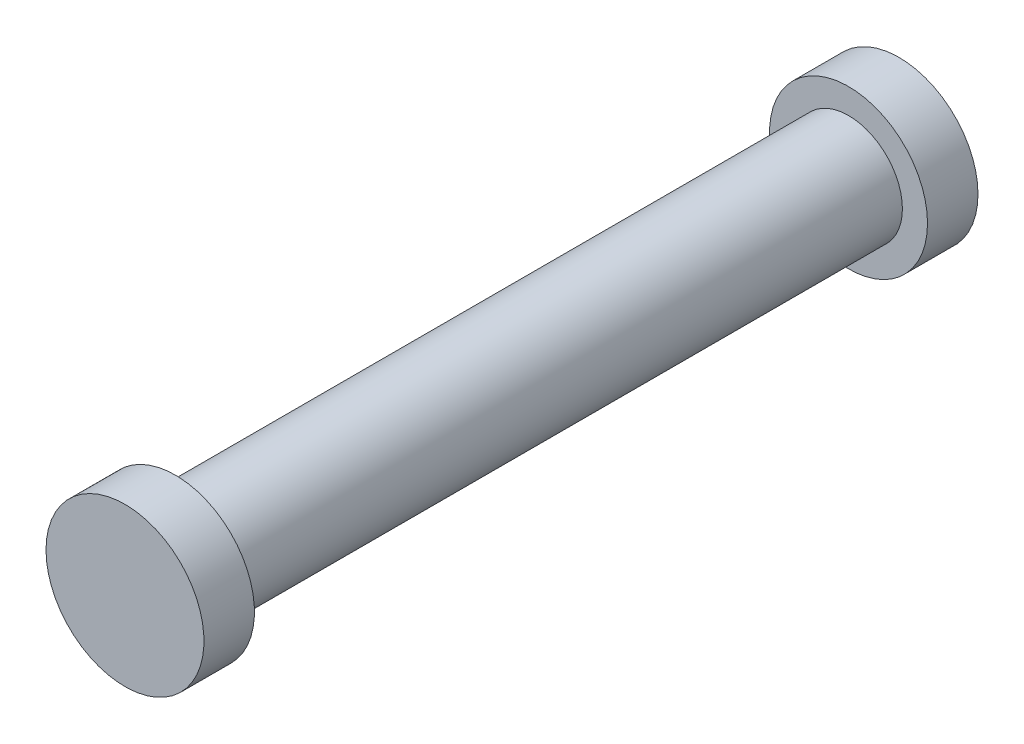
from build123d import *

# Parameters (mm, degrees)
SKETCH1_R           = 4.064
BOSS_EXTRUDE1_DEPTH = 50.8
SKETCH2_R           = 5.960535796
BOSS_EXTRUDE2_DEPTH = 3.81
BOSS_EXTRUDE3_START = 3.81
SKETCH3_R           = 5.960535796
BOSS_EXTRUDE3_DEPTH = 3.81


with BuildPart() as part:
    # Sketch1 → Boss-Extrude1 (new body)
    with BuildSketch(Plane.XY):
        Circle(SKETCH1_R)
    extrude(amount=BOSS_EXTRUDE1_DEPTH)

    # Sketch2 → Boss-Extrude2 (add)
    with BuildSketch(Plane.XY.offset(50.8)):
        with Locations(Location((0, 0, 0), (0, 0, 180))):
            Circle(SKETCH2_R)
    extrude(amount=BOSS_EXTRUDE2_DEPTH)

    # Sketch3 → Boss-Extrude3 (add)
    with BuildSketch(Plane(origin=(0, 0, 0), x_dir=(-1, 0, 0), z_dir=(0, 0, -1)).offset(BOSS_EXTRUDE3_START)):
        Circle(SKETCH3_R)
    extrude(amount=-BOSS_EXTRUDE3_DEPTH)


solid = part.part
